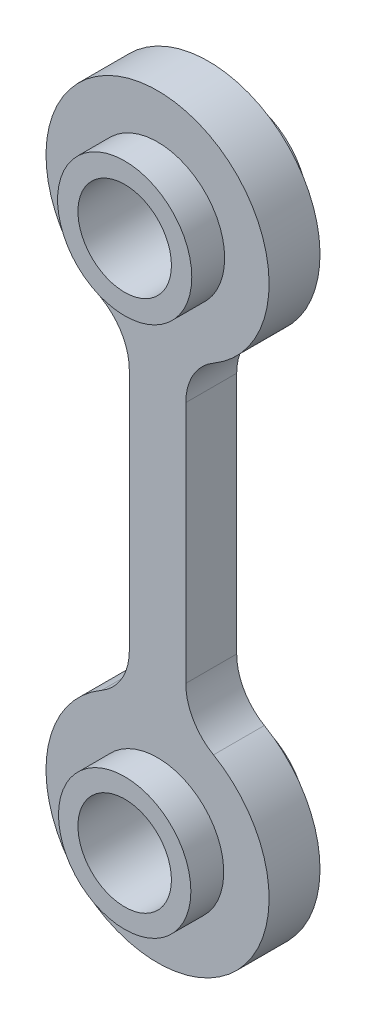
from build123d import *

# Parameters (mm, degrees)
SKETCH1_R                       = 7.15
SKETCH1_R_2                     = 5.05
BOSS_EXTRUDE1_DEPTH             = 12.6
BOSS_EXTRUDE2_DEPTH             = 2.75
BOSS_EXTRUDE2_DEPTH_BACK        = 2.75
SKETCH2_R                       = 7.2
SKETCH2_R_2                     = 7.15
BOSS_EXTRUDE3_REACH             = 73.164
SKETCH3_R                       = 7.248211447
SKETCH3_R_2                     = 5.05
BOSS_EXTRUDE3_DIRECTION_2_REACH = 73.164


with BuildPart() as part:
    # Sketch1 → Boss-Extrude1 (new body)
    with BuildSketch(Plane.XY):
        Circle(SKETCH1_R)
        Circle(SKETCH1_R_2, mode=Mode.SUBTRACT)
    extrude(amount=BOSS_EXTRUDE1_DEPTH)

    # Sketch2 → Boss-Extrude2 (add, two sides: drawn at the far end of the back side and taken through both)
    with BuildSketch(Plane(origin=(0, 0, 6.3), x_dir=(-1, 0, 0), z_dir=(0, 0, -1)).offset(-BOSS_EXTRUDE2_DEPTH_BACK)):
        with BuildLine():
            Line((3.05, 15.617298102), (3.05, 41.882701898))
            ThreePointArc((3.05, 41.882701898), (3.851449168, 44.878543892), (6.041689751, 47.074047528))
            ThreePointArc((6.041689751, 47.074047528), (0, 69.55), (-6.041689751, 47.074047528))
            ThreePointArc((-6.041689751, 47.074047528), (-3.851449168, 44.878543892), (-3.05, 41.882701898))
            Line((-3.05, 41.882701898), (-3.05, 15.617298102))
            ThreePointArc((-3.05, 15.617298102), (-3.851449168, 12.621456108), (-6.041689751, 10.425952472))
            ThreePointArc((-6.041689751, 10.425952472), (0, -12.05), (6.041689751, 10.425952472))
            ThreePointArc((6.041689751, 10.425952472), (3.851449168, 12.621456108), (3.05, 15.617298102))
        make_face()
        with Locations((0, 57.5)):
            Circle(SKETCH2_R, mode=Mode.SUBTRACT)
        with Locations(Location((0, 0, 0), (0, 0, 180))):
            Circle(SKETCH2_R_2, mode=Mode.SUBTRACT)
    extrude(amount=BOSS_EXTRUDE2_DEPTH + BOSS_EXTRUDE2_DEPTH_BACK)

    # Boss-Extrude3: up to this face of the body (flat: up to its plane)
    boss_extrude3_end = Plane(part.part.faces().sort_by_distance((-6.947767461, 0, 0))[0])
    # Sketch3 → Boss-Extrude3 (add, up to the picked face)
    with BuildSketch(Plane(origin=(0, 0, 3.55), x_dir=(-1, 0, 0), z_dir=(0, 0, -1)), mode=Mode.PRIVATE) as boss_extrude3_sk1:
        with Locations(Location((0, 57.5, 0), (0, 0, 180))):
            Circle(SKETCH3_R)
        with Locations(Location((0, 57.5, 0), (0, 0, 180))):
            Circle(SKETCH3_R_2, mode=Mode.SUBTRACT)
    boss_extrude3_tool1 = split(extrude(boss_extrude3_sk1.sketch, amount=BOSS_EXTRUDE3_REACH, mode=Mode.PRIVATE), bisect_by=boss_extrude3_end, keep=Keep.BOTH, mode=Mode.PRIVATE)
    add(boss_extrude3_tool1.solids().sort_by(Axis((-7.043201, 57.5, 3.55), (0, 0, -1)))[0])

    # Boss-Extrude3 direction 2: up to this face of the body (flat: up to its plane)
    boss_extrude3_direction_2_end = Plane(part.part.faces().sort_by_distance((-6.947767461, 0, 12.6))[0])
    # Sketch3 → Boss-Extrude3 direction 2 (add, up to the picked face)
    with BuildSketch(Plane(origin=(0, 0, 3.55), x_dir=(-1, 0, 0), z_dir=(0, 0, -1)), mode=Mode.PRIVATE) as boss_extrude3_direction_2_sk1:
        with Locations(Location((0, 57.5, 0), (0, 0, 180))):
            Circle(SKETCH3_R)
        with Locations(Location((0, 57.5, 0), (0, 0, 180))):
            Circle(SKETCH3_R_2, mode=Mode.SUBTRACT)
    boss_extrude3_direction_2_tool1 = split(extrude(boss_extrude3_direction_2_sk1.sketch, amount=-BOSS_EXTRUDE3_DIRECTION_2_REACH, mode=Mode.PRIVATE), bisect_by=boss_extrude3_direction_2_end, keep=Keep.BOTH, mode=Mode.PRIVATE)
    add(boss_extrude3_direction_2_tool1.solids().sort_by(Axis((-7.043201, 57.5, 3.55), (0, 0, 1)))[0])


solid = part.part
